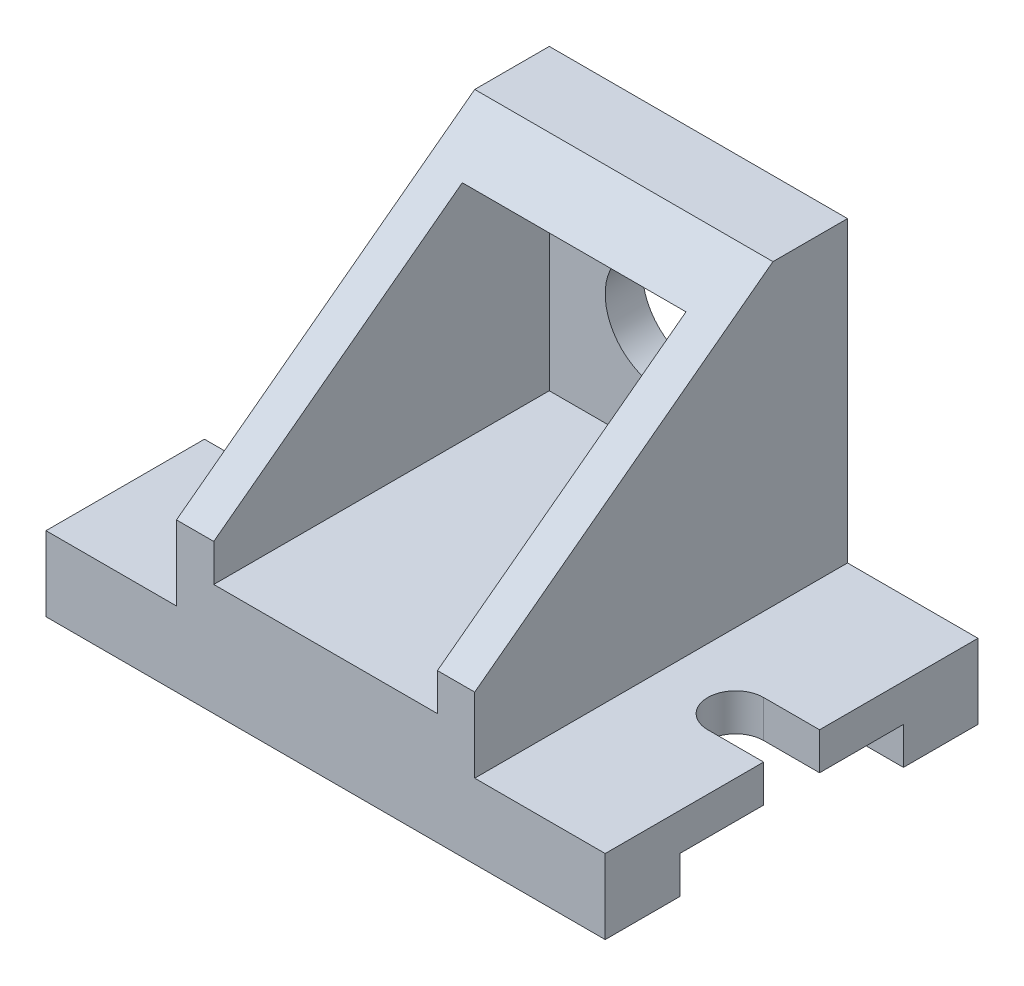
from build123d import *

# Parameters (mm, degrees)
BOSS_EXTRUDE1_DEPTH = 150
BOSS_EXTRUDE2_DEPTH = 80
SKETCH3_W           = 60
SKETCH3_H           = 60
CUT_EXTRUDE1_DEPTH  = 197.723155729
SKETCH4_R           = 15
CUT_EXTRUDE2_DEPTH  = 80
CUT_EXTRUDE3_DEPTH  = 178.200451467


with BuildPart() as part:
    # Sketch1 → Boss-Extrude1 (new body)
    with BuildSketch(Plane(origin=(0, 0, 0), x_dir=(0, 0, -1), z_dir=(1, 0, 0))):
        Polygon((50, -10), (30, -10), (30, 0), (-30, 0), (-30, -10), (-50, -10), (-50, 10), (50, 10), align=None)
    extrude(amount=BOSS_EXTRUDE1_DEPTH)

    # Sketch2 → Boss-Extrude2 (add)
    with BuildSketch(Plane.ZY.offset(-35)):
        Polygon((50, 10), (50, 30), (-30, 90), (-50, 90), (-50, 10), align=None)
    extrude(amount=-BOSS_EXTRUDE2_DEPTH)

    # Sketch3 → Cut-Extrude1 (cut, through all)
    with BuildSketch(Plane(origin=(0, 0, -40), x_dir=(-1, 0, 0), z_dir=(0, 0, -1))):
        with Locations((-75, 50)):
            Rectangle(SKETCH3_W, SKETCH3_H)
    extrude(amount=-CUT_EXTRUDE1_DEPTH, mode=Mode.SUBTRACT)

    # Sketch4 → Cut-Extrude2 (cut)
    with BuildSketch(Plane.XY.offset(-40)):
        with Locations((75, 50)):
            Circle(SKETCH4_R)
    extrude(amount=-CUT_EXTRUDE2_DEPTH, mode=Mode.SUBTRACT)

    # Sketch5 → Cut-Extrude3 (cut, through all)
    with BuildSketch(Plane(origin=(0, 10, 0), x_dir=(1, 0, 0), z_dir=(0, 1, 0))):
        with BuildLine():
            Line((15, 7.5), (0, 7.5))
            Line((0, 7.5), (0, -7.5))
            Line((0, -7.5), (15, -7.5))
            ThreePointArc((15, -7.5), (22.5, 0), (15, 7.5))
        make_face()
        with BuildLine():
            Line((150, -7.5), (150, 7.5))
            Line((150, 7.5), (135, 7.5))
            ThreePointArc((135, 7.5), (127.5, 0), (135, -7.5))
            Line((135, -7.5), (150, -7.5))
        make_face()
    extrude(amount=-CUT_EXTRUDE3_DEPTH, mode=Mode.SUBTRACT)


solid = part.part
